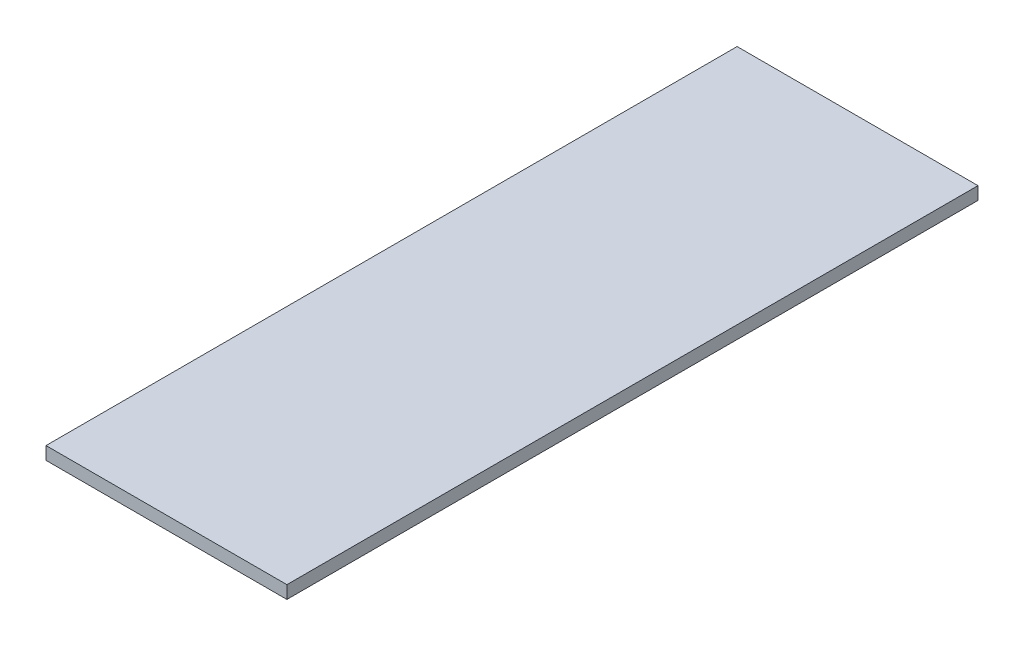
from build123d import *

# Parameters (mm, degrees)
SKETCH1_W           = 122
SKETCH1_H           = 350
BOSS_EXTRUDE1_DEPTH = 6.5


with BuildPart() as part:
    # Sketch1 → Boss-Extrude1 (new body)
    with BuildSketch(Plane(origin=(0, 0, 0), x_dir=(1, 0, 0), z_dir=(0, 1, 0))):
        with Locations((61, 175)):
            Rectangle(SKETCH1_W, SKETCH1_H)
    extrude(amount=BOSS_EXTRUDE1_DEPTH)


solid = part.part
